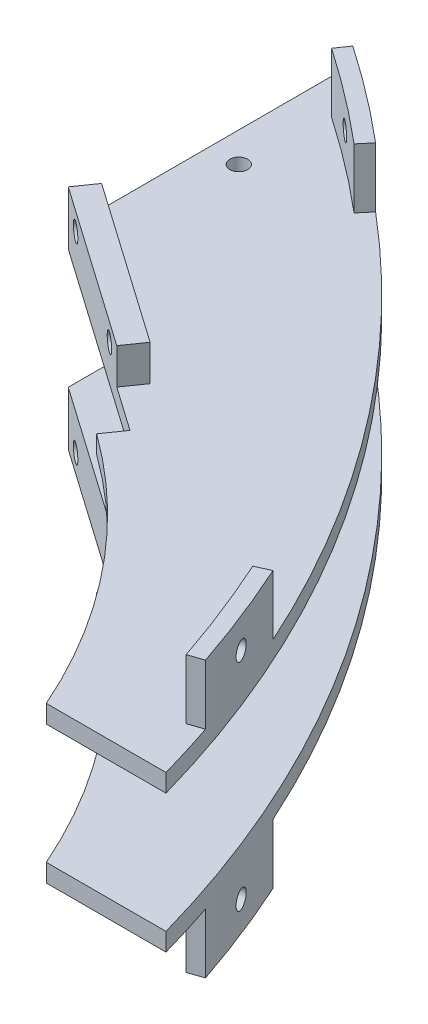
from build123d import *
from build123d.topology import SkipClean

# Parameters (mm, degrees)
BOSS_EXTRUDE1_DEPTH = 3
BOSS_EXTRUDE2_DEPTH = 6
SKETCH3_R           = 1.5
SKETCH3_W           = 9.001604742
SKETCH3_H           = 6
SKETCH3_W_2         = 4.02
CUT_EXTRUDE1_DEPTH  = 127.726009226
BOSS_EXTRUDE3_DEPTH = 3
BOSS_EXTRUDE4_START = 10
BOSS_EXTRUDE4_DEPTH = 10
SKETCH8_R           = 1.5
CUT_EXTRUDE2_DEPTH  = 128.550079345
SKETCH9_R           = 1.5
CUT_EXTRUDE3_DEPTH  = 140.296860914
CUT_EXTRUDE5_DEPTH  = 135.942804558
SKETCH10_R          = 1.5
CUT_EXTRUDE4_DEPTH  = 135.942804558


with BuildPart() as part:
    # Sketch1 → Boss-Extrude1 (new body)
    with BuildSketch(Plane(origin=(0, 0, 0), x_dir=(1, 0, 0), z_dir=(0, 1, 0))):
        with BuildLine():
            Line((0, 0), (20, 0))
            ThreePointArc((20, 0), (-12.999728612, 66.379532688), (-67.91, 116.18))
            Line((-67.91, 116.18), (-67.91, 72.58))
            ThreePointArc((-67.91, 72.58), (-27.76846685, 42.078474321), (0, 0))
        make_face()
    extrude(amount=BOSS_EXTRUDE1_DEPTH)

    # Sketch2 → Boss-Extrude2 (add)
    with BuildSketch(Plane.XZ):
        Polygon((-66.91, -70.583412503), (-32.50561414, -46.493202176), (-32.50561414, -51.376300531), (-67.91, -76.166718396), (-67.91, -71.283620041), align=None)
    extrude(amount=BOSS_EXTRUDE2_DEPTH)

    # Sketch3 → Cut-Extrude1 (cut, through all)
    with BuildSketch(Plane(origin=(13.44494558, 0, -19.201372231), x_dir=(-0.8191520442889929, 0, -0.5735764363510446), z_dir=(0.5735764363510446, 0, -0.819152044288993))):
        with Locations((90.296050234, -3)):
            Circle(SKETCH3_R)
        with Locations((67.296050234, -3)):
            Circle(SKETCH3_R)
        with Locations((57.795247863, -3)):
            Rectangle(SKETCH3_W, SKETCH3_H)
        with Locations((97.306050234, -3)):
            Rectangle(SKETCH3_W_2, SKETCH3_H)
    extrude(amount=-CUT_EXTRUDE1_DEPTH, mode=Mode.SUBTRACT)

    # Sketch5 → Boss-Extrude3 (add)
    with BuildSketch(Plane(origin=(0, 0, 0), x_dir=(1, 0, 0), z_dir=(0, 1, 0))):
        with BuildLine():
            Line((-66.911314527, 70.584332945), (-67.91, 70.584332945))
            Line((-67.91, 70.584332945), (-67.91, 72.58))
            ThreePointArc((-67.91, 72.58), (-27.76846685, 42.078474321), (0, 0))
            ThreePointArc((0, 0), (-14.53687211, 23.913782415), (-34.799919885, 43.216593999))
            Line((-34.799919885, 43.216593999), (-32.50561414, 46.493202176))
            Line((-32.50561414, 46.493202176), (-66.911314527, 70.584332945))
        make_face()
    extrude(amount=BOSS_EXTRUDE3_DEPTH)

    # Sketch6 → Boss-Extrude4 (add)
    with SkipClean():  # the faces are left unmerged after this step: merging them gives an invalid solid
        with BuildSketch(Plane.XZ.offset(BOSS_EXTRUDE4_START)):
            with BuildLine():
                Line((17.045225443, -9.553497125), (14.627759947, -8.739050999))
                ThreePointArc((14.627759947, -8.739050999), (11.241753199, -18.015971085), (7.396135604, -27.111987428))
                Line((7.396135604, -27.111987428), (9.72017103, -28.163805501))
                ThreePointArc((9.72017103, -28.163805501), (13.615472666, -18.950271792), (17.045225443, -9.553497125))
            make_face()
            with BuildLine():
                Line((-43.600864087, -98.631759771), (-45.244796978, -96.681132546))
                ThreePointArc((-45.244796978, -96.681132546), (-52.953020273, -102.854428394), (-60.960267052, -108.634591628))
                Line((-60.960267052, -108.634591628), (-59.519372567, -110.739653386))
                ThreePointArc((-59.519372567, -110.739653386), (-51.408674946, -104.884812453), (-43.600864087, -98.631759771))
            make_face()
        extrude(amount=-BOSS_EXTRUDE4_DEPTH)

    # Sketch8 → Cut-Extrude2 (cut, through all)
    with SkipClean():  # the faces are left unmerged after this step: merging them gives an invalid solid
        with BuildSketch(Plane(origin=(-51.408674946, -10, -104.884812453), x_dir=(-0.7959254239888501, 0, -0.6053946807233849), z_dir=(0.6053946807233849, 0, -0.7959254239888501))):
            with Locations((0, 5)):
                Circle(SKETCH8_R)
        extrude(amount=-CUT_EXTRUDE2_DEPTH, mode=Mode.SUBTRACT)

    # Sketch9 → Cut-Extrude3 (cut, through all)
    with SkipClean():  # the faces are left unmerged after this step: merging them gives an invalid solid
        with BuildSketch(Plane(origin=(18.247403502, 0, -7.182214333), x_dir=(-0.36625272068036263, 0, -0.9305154187837149), z_dir=(0.9305154187837149, 0, -0.36625272068036263))):
            with Locations((12.646816185, -5)):
                Circle(SKETCH9_R)
        extrude(amount=-CUT_EXTRUDE3_DEPTH, mode=Mode.SUBTRACT)

    # Sketch11 → Cut-Extrude5 (cut, through all)
    with SkipClean():  # the faces are left unmerged after this step: merging them gives an invalid solid
        with BuildSketch(Plane.XZ):
            with BuildLine():
                Line((-66.91, -70.583412503), (-66.91, -115.562519451))
                Line((-66.91, -115.562519451), (-66.91, -117.748905653))
                Line((-66.91, -117.748905653), (-78.626173162, -99.102139907))
                ThreePointArc((-78.626173162, -99.102139907), (-78.831832297, -91.769406487), (-72.513559714, -88.042382652))
                Line((-72.513559714, -88.042382652), (-69.539157742, -68.426897103))
                Line((-69.539157742, -68.426897103), (-66.91, -70.583412503))
            make_face()
        extrude(amount=-CUT_EXTRUDE5_DEPTH, mode=Mode.SUBTRACT)


with BuildPart() as cut_extrude5_piece_1:
    # of the separate pieces the step leaves, piece 1, a body of its own (cut_extrude5_pieces)
    add(part.part.solids().sort_by_distance((-64.617008782, 0, -73.860941122))[0])

    # Sketch10 → Cut-Extrude4 (cut, through all)
    with SkipClean():  # the faces are left unmerged after this step: merging them gives an invalid solid
        with BuildSketch(Plane.XZ):
            with Locations(Location((-61.91, -94.074364868, 0), (0, 0, 270))):
                Circle(SKETCH10_R)
        extrude(amount=-CUT_EXTRUDE4_DEPTH, mode=Mode.SUBTRACT)


with BuildPart() as cut_extrude5_piece_2:
    # of the separate pieces the step leaves, piece 2, a body of its own (cut_extrude5_pieces)
    add(part.part.solids().sort_by_distance((-67.91, 0, -116.18))[0])


with BuildPart() as body_3:
    # Mirror2: mirrored copy
    add(cut_extrude5_piece_1.part.mirror(Plane.ZX.offset(13)))


solid = Compound([cut_extrude5_piece_1.part, cut_extrude5_piece_2.part, body_3.part])
